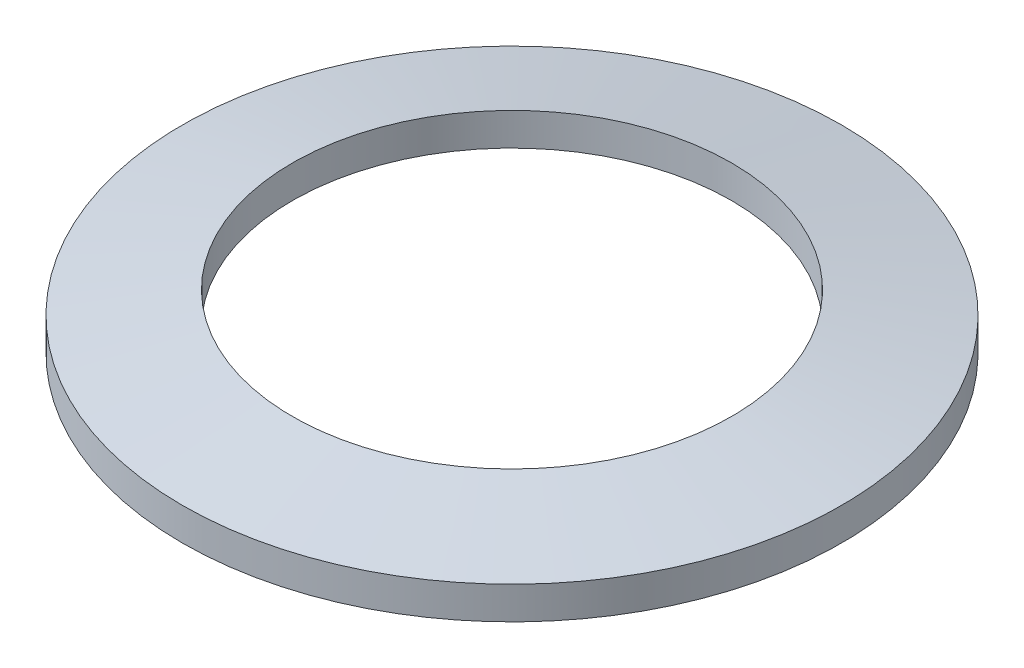
from build123d import *


with BuildPart() as part:
    # Sketch1 → Revolve1 (revolve)
    with BuildSketch(Plane.XY, mode=Mode.PRIVATE) as revolve1_sk:
        Polygon((-14.9987, 0), (-9.9949, 1.003504931), (-9.9949, 2.4892), (-14.9987, 1.485695069), align=None)
    revolve(revolve1_sk.sketch.rotate(Axis((0, 0, 0), (0, 1, 0)), 270), axis=Axis((0, 0, 0), (0, 1, 0)))


solid = part.part
